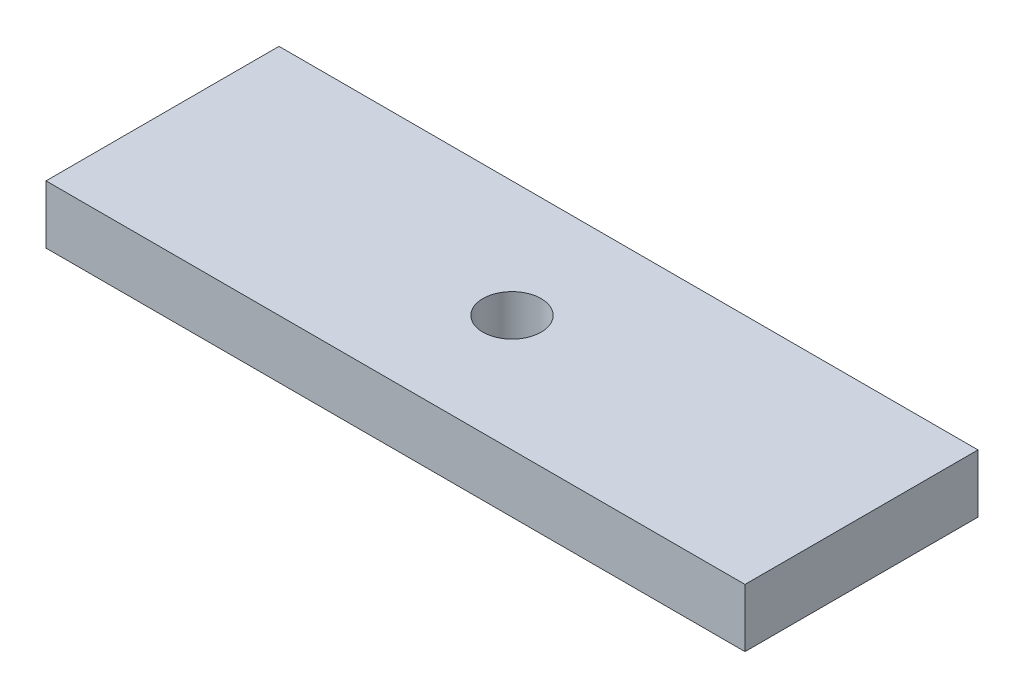
from build123d import *

# Parameters (mm, degrees)
SKETCH1_W           = 60
SKETCH1_H           = 20
BOSS_EXTRUDE1_DEPTH = 5
SKETCH2_R           = 2.5
CUT_EXTRUDE1_DEPTH  = 33.015621187


with BuildPart() as part:
    # Sketch1 → Boss-Extrude1 (new body)
    with BuildSketch(Plane(origin=(0, 0, 0), x_dir=(1, 0, 0), z_dir=(0, 1, 0))):
        Rectangle(SKETCH1_W, SKETCH1_H)
    extrude(amount=BOSS_EXTRUDE1_DEPTH)

    # Sketch2 → Cut-Extrude1 (cut, through all)
    with BuildSketch(Plane(origin=(0, 5, 0), x_dir=(1, 0, 0), z_dir=(0, 1, 0))):
        with Locations(Location((0, 0, 0), (0, 0, 270))):
            Circle(SKETCH2_R)
    extrude(amount=-CUT_EXTRUDE1_DEPTH, mode=Mode.SUBTRACT)


solid = part.part
